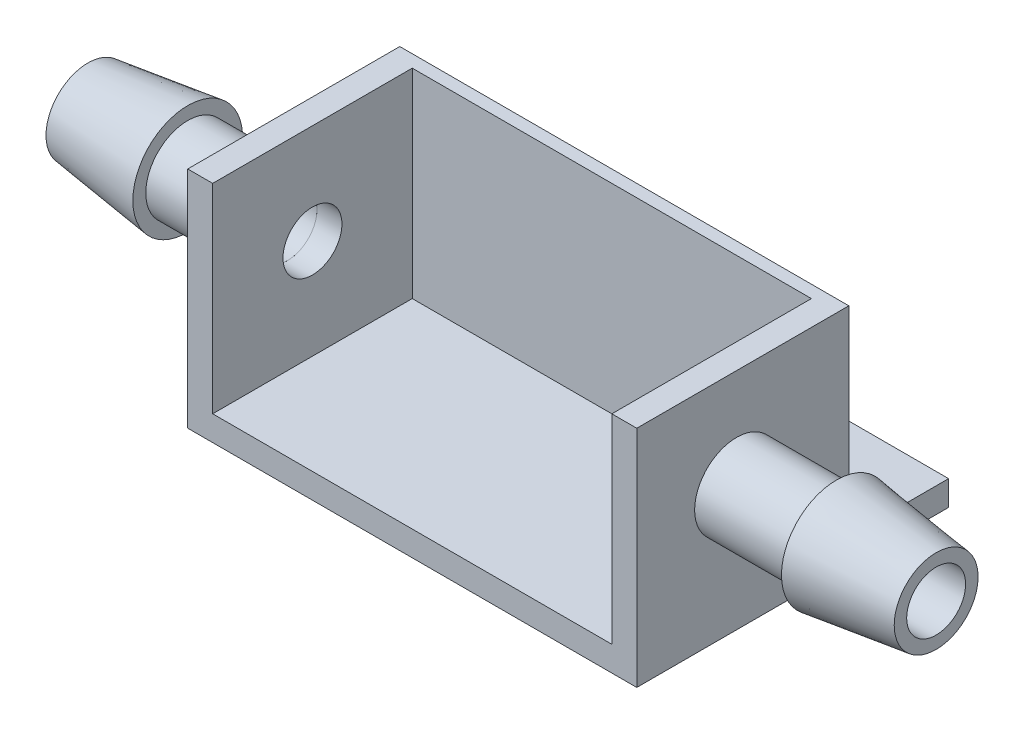
from build123d import *

# Parameters (mm, degrees)
BOSS_EXTRUDE1_DEPTH     = 25.4
SKETCH2_W               = 114.3
SKETCH2_H               = 57.15
BOSS_EXTRUDE2_DEPTH     = 3.175
CUT_EXTRUDE2_DEPTH      = 126.442638784
CUT_EXTRUDE2_DEPTH_BACK = 126.442638784
SKETCH3_R               = 7.5
SKETCH5_W               = 114.3
SKETCH5_H               = 25.4
SKETCH5_R               = 3.4925
BOSS_EXTRUDE3_DEPTH     = 6.35


with BuildPart() as part:
    # Sketch1 → Boss-Extrude1 (new, symmetric)
    with BuildSketch(Plane.XY):
        Polygon((-57.15, 0), (57.15, 0), (57.15, 6.35), (57.15, 57.15), (50.8, 57.15), (50.8, 6.35), (-50.8, 6.35), (-50.8, 57.15), (-57.15, 57.15), (-57.15, 6.35), align=None)
    extrude(amount=BOSS_EXTRUDE1_DEPTH, both=True)

    # Sketch2 → Boss-Extrude2 (add)
    with BuildSketch(Plane(origin=(0, 0, -25.4), x_dir=(-1, 0, 0), z_dir=(0, 0, -1))):
        with Locations((0, 28.575)):
            Rectangle(SKETCH2_W, SKETCH2_H)
    extrude(amount=BOSS_EXTRUDE2_DEPTH)

    # Sketch3 → Cut-Extrude2 (cut, two sides: drawn at the far end of the back side and taken through both)
    with BuildSketch(Plane(origin=(0, 0, 0), x_dir=(0, 0, -1), z_dir=(1, 0, 0)).offset(-CUT_EXTRUDE2_DEPTH_BACK)):
        with Locations(Location((0, 31.75, 0), (0, 0, 180))):
            Circle(SKETCH3_R)
    extrude(amount=CUT_EXTRUDE2_DEPTH + CUT_EXTRUDE2_DEPTH_BACK, mode=Mode.SUBTRACT)

    # Sketch5 → Boss-Extrude3 (add)
    with BuildSketch(Plane.XZ):
        with Locations((0, -41.275)):
            Rectangle(SKETCH5_W, SKETCH5_H)
        with Locations(Location((38.1, -41.275, 0), (0, 0, 270))):
            Circle(SKETCH5_R, mode=Mode.SUBTRACT)
        with Locations(Location((12.7, -41.275, 0), (0, 0, 270))):
            Circle(SKETCH5_R, mode=Mode.SUBTRACT)
        with Locations(Location((-12.7, -41.275, 0), (0, 0, 270))):
            Circle(SKETCH5_R, mode=Mode.SUBTRACT)
        with Locations(Location((-38.1, -41.275, 0), (0, 0, 270))):
            Circle(SKETCH5_R, mode=Mode.SUBTRACT)
    extrude(amount=-BOSS_EXTRUDE3_DEPTH)


with BuildPart() as body_2:
    # Sketch4 → Revolve1 (revolve)
    with BuildSketch(Plane.XY, mode=Mode.PRIVATE) as revolve1_sk:
        Polygon((57.15, 39.25), (57.15, 42.425), (82.55, 42.425), (82.55, 45.72), (107.95, 42.425), (107.95, 39.25), align=None)
        Polygon((-57.15, 42.425), (-82.55, 42.425), (-82.55, 45.72), (-107.95, 42.425), (-107.95, 39.25), (-57.15, 39.25), align=None)
    revolve(revolve1_sk.sketch.rotate(Axis((-76.2, 31.75, 0), (1, 0, 0)), 90), axis=Axis((-76.2, 31.75, 0), (1, 0, 0)))


solid = Compound([part.part, body_2.part])
